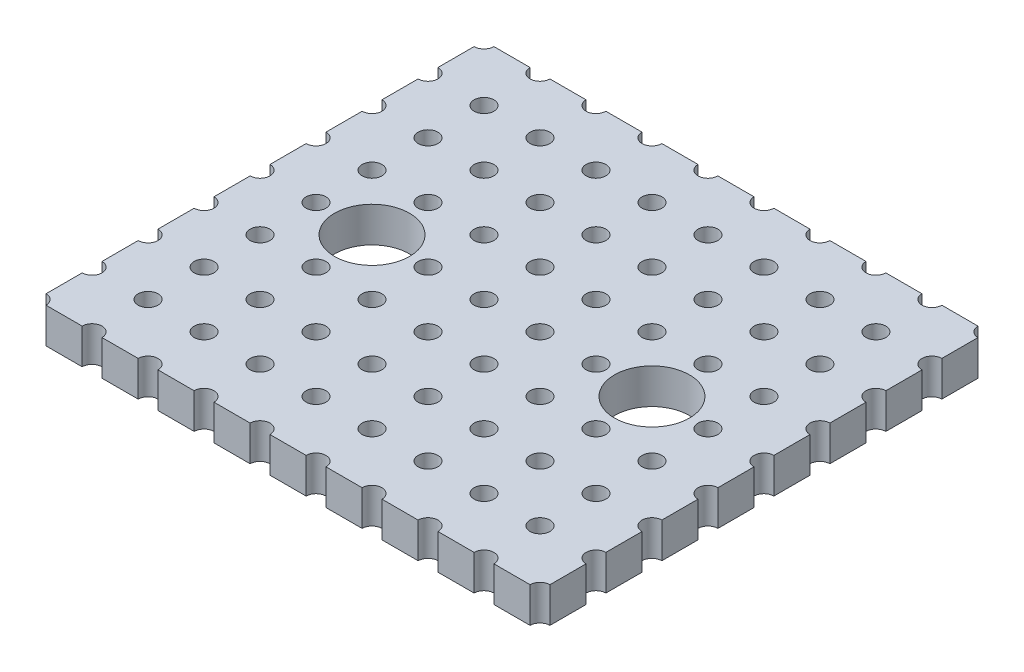
from build123d import *

# Parameters (mm, degrees)
ESQUISSE1_W             = 22.86
ESQUISSE1_H             = 20.32
BOSS_EXTRU_1_DEPTH      = 1.6
ESQUISSE2_R             = 0.45
ENL_V_MAT_EXTRU_1_DEPTH = 26.387611646
D_GAGEMENT_M31_D        = 3.4


with BuildPart() as part:
    # Esquisse1 → Boss.-Extru.1 (new body)
    with BuildSketch(Plane(origin=(0, 0, 0), x_dir=(1, 0, 0), z_dir=(0, 1, 0))):
        with Locations((7.545294118, -6.630147059)):
            Rectangle(ESQUISSE1_W, ESQUISSE1_H)
    extrude(amount=BOSS_EXTRU_1_DEPTH)

    # Esquisse2 → Enlèv. mat.-Extru.1 (cut, through all)
    with BuildSketch(Plane(origin=(0, 1.6, 0), x_dir=(1, 0, 0), z_dir=(0, 1, 0))):
        with Locations((-3.884705882, 3.529852941)):
            Circle(ESQUISSE2_R)
        with Locations((-1.344705882, 3.529852941)):
            Circle(ESQUISSE2_R)
        with Locations((1.195294118, 3.529852941)):
            Circle(ESQUISSE2_R)
        with Locations((3.735294118, 3.529852941)):
            Circle(ESQUISSE2_R)
        with Locations(Location((-1.344705882, 0.989852941, 0), (0, 0, 270))):
            Circle(ESQUISSE2_R)
        with Locations(Location((1.195294118, 0.989852941, 0), (0, 0, 270))):
            Circle(ESQUISSE2_R)
        with Locations(Location((3.735294118, 0.989852941, 0), (0, 0, 270))):
            Circle(ESQUISSE2_R)
        with Locations(Location((-1.344705882, -1.550147059, 0), (0, 0, 270))):
            Circle(ESQUISSE2_R)
        with Locations(Location((1.195294118, -1.550147059, 0), (0, 0, 270))):
            Circle(ESQUISSE2_R)
        with Locations(Location((3.735294118, -1.550147059, 0), (0, 0, 270))):
            Circle(ESQUISSE2_R)
        with Locations(Location((-1.344705882, -4.090147059, 0), (0, 0, 270))):
            Circle(ESQUISSE2_R)
        with Locations(Location((1.195294118, -4.090147059, 0), (0, 0, 270))):
            Circle(ESQUISSE2_R)
        with Locations(Location((3.735294118, -4.090147059, 0), (0, 0, 270))):
            Circle(ESQUISSE2_R)
        with Locations(Location((-1.344705882, -6.630147059, 0), (0, 0, 270))):
            Circle(ESQUISSE2_R)
        with Locations(Location((1.195294118, -6.630147059, 0), (0, 0, 270))):
            Circle(ESQUISSE2_R)
        with Locations(Location((3.735294118, -6.630147059, 0), (0, 0, 270))):
            Circle(ESQUISSE2_R)
        with Locations(Location((-1.344705882, -9.170147059, 0), (0, 0, 270))):
            Circle(ESQUISSE2_R)
        with Locations(Location((1.195294118, -9.170147059, 0), (0, 0, 270))):
            Circle(ESQUISSE2_R)
        with Locations(Location((3.735294118, -9.170147059, 0), (0, 0, 270))):
            Circle(ESQUISSE2_R)
        with Locations(Location((-1.344705882, -11.710147059, 0), (0, 0, 270))):
            Circle(ESQUISSE2_R)
        with Locations(Location((1.195294118, -11.710147059, 0), (0, 0, 270))):
            Circle(ESQUISSE2_R)
        with Locations(Location((3.735294118, -11.710147059, 0), (0, 0, 270))):
            Circle(ESQUISSE2_R)
        with Locations(Location((-1.344705882, -14.250147059, 0), (0, 0, 270))):
            Circle(ESQUISSE2_R)
        with Locations(Location((1.195294118, -14.250147059, 0), (0, 0, 270))):
            Circle(ESQUISSE2_R)
        with Locations(Location((3.735294118, -14.250147059, 0), (0, 0, 270))):
            Circle(ESQUISSE2_R)
        with Locations((-3.884705882, 0.989852941)):
            Circle(ESQUISSE2_R)
        with Locations((-3.884705882, -1.550147059)):
            Circle(ESQUISSE2_R)
        with Locations((-3.884705882, -4.090147059)):
            Circle(ESQUISSE2_R)
        with Locations((-3.884705882, -6.630147059)):
            Circle(ESQUISSE2_R)
        with Locations((-3.884705882, -9.170147059)):
            Circle(ESQUISSE2_R)
        with Locations((-3.884705882, -11.710147059)):
            Circle(ESQUISSE2_R)
        with Locations((-3.884705882, -14.250147059)):
            Circle(ESQUISSE2_R)
        with Locations((6.275294118, 3.529852941)):
            Circle(ESQUISSE2_R)
        with Locations(Location((6.275294118, 0.989852941, 0), (0, 0, 270))):
            Circle(ESQUISSE2_R)
        with Locations(Location((6.275294118, -1.550147059, 0), (0, 0, 270))):
            Circle(ESQUISSE2_R)
        with Locations(Location((6.275294118, -4.090147059, 0), (0, 0, 270))):
            Circle(ESQUISSE2_R)
        with Locations(Location((6.275294118, -6.630147059, 0), (0, 0, 270))):
            Circle(ESQUISSE2_R)
        with Locations(Location((6.275294118, -9.170147059, 0), (0, 0, 270))):
            Circle(ESQUISSE2_R)
        with Locations(Location((6.275294118, -11.710147059, 0), (0, 0, 270))):
            Circle(ESQUISSE2_R)
        with Locations(Location((6.275294118, -14.250147059, 0), (0, 0, 270))):
            Circle(ESQUISSE2_R)
        with Locations((-3.884705882, -16.790147059)):
            Circle(ESQUISSE2_R)
        with Locations((-1.344705882, -16.790147059)):
            Circle(ESQUISSE2_R)
        with Locations((1.195294118, -16.790147059)):
            Circle(ESQUISSE2_R)
        with Locations((3.735294118, -16.790147059)):
            Circle(ESQUISSE2_R)
        with Locations((6.275294118, -16.790147059)):
            Circle(ESQUISSE2_R)
        with Locations((8.815294118, 3.529852941)):
            Circle(ESQUISSE2_R)
        with Locations((11.355294118, 3.529852941)):
            Circle(ESQUISSE2_R)
        with Locations((13.895294118, 3.529852941)):
            Circle(ESQUISSE2_R)
        with Locations((16.435294118, 3.529852941)):
            Circle(ESQUISSE2_R)
        with Locations((18.975294118, 3.529852941)):
            Circle(ESQUISSE2_R)
        with Locations(Location((8.815294118, 0.989852941, 0), (0, 0, 270))):
            Circle(ESQUISSE2_R)
        with Locations(Location((11.355294118, 0.989852941, 0), (0, 0, 270))):
            Circle(ESQUISSE2_R)
        with Locations(Location((13.895294118, 0.989852941, 0), (0, 0, 270))):
            Circle(ESQUISSE2_R)
        with Locations(Location((16.435294118, 0.989852941, 0), (0, 0, 270))):
            Circle(ESQUISSE2_R)
        with Locations((18.975294118, 0.989852941)):
            Circle(ESQUISSE2_R)
        with Locations(Location((8.815294118, -1.550147059, 0), (0, 0, 270))):
            Circle(ESQUISSE2_R)
        with Locations(Location((11.355294118, -1.550147059, 0), (0, 0, 270))):
            Circle(ESQUISSE2_R)
        with Locations(Location((13.895294118, -1.550147059, 0), (0, 0, 270))):
            Circle(ESQUISSE2_R)
        with Locations(Location((16.435294118, -1.550147059, 0), (0, 0, 270))):
            Circle(ESQUISSE2_R)
        with Locations((18.975294118, -1.550147059)):
            Circle(ESQUISSE2_R)
        with Locations(Location((8.815294118, -4.090147059, 0), (0, 0, 270))):
            Circle(ESQUISSE2_R)
        with Locations(Location((11.355294118, -4.090147059, 0), (0, 0, 270))):
            Circle(ESQUISSE2_R)
        with Locations(Location((13.895294118, -4.090147059, 0), (0, 0, 270))):
            Circle(ESQUISSE2_R)
        with Locations(Location((16.435294118, -4.090147059, 0), (0, 0, 270))):
            Circle(ESQUISSE2_R)
        with Locations((18.975294118, -4.090147059)):
            Circle(ESQUISSE2_R)
        with Locations(Location((8.815294118, -6.630147059, 0), (0, 0, 270))):
            Circle(ESQUISSE2_R)
        with Locations(Location((11.355294118, -6.630147059, 0), (0, 0, 270))):
            Circle(ESQUISSE2_R)
        with Locations(Location((13.895294118, -6.630147059, 0), (0, 0, 270))):
            Circle(ESQUISSE2_R)
        with Locations(Location((16.435294118, -6.630147059, 0), (0, 0, 270))):
            Circle(ESQUISSE2_R)
        with Locations((18.975294118, -6.630147059)):
            Circle(ESQUISSE2_R)
        with Locations(Location((8.815294118, -9.170147059, 0), (0, 0, 270))):
            Circle(ESQUISSE2_R)
        with Locations(Location((11.355294118, -9.170147059, 0), (0, 0, 270))):
            Circle(ESQUISSE2_R)
        with Locations(Location((13.895294118, -9.170147059, 0), (0, 0, 270))):
            Circle(ESQUISSE2_R)
        with Locations(Location((16.435294118, -9.170147059, 0), (0, 0, 270))):
            Circle(ESQUISSE2_R)
        with Locations((18.975294118, -9.170147059)):
            Circle(ESQUISSE2_R)
        with Locations(Location((8.815294118, -11.710147059, 0), (0, 0, 270))):
            Circle(ESQUISSE2_R)
        with Locations(Location((11.355294118, -11.710147059, 0), (0, 0, 270))):
            Circle(ESQUISSE2_R)
        with Locations(Location((13.895294118, -11.710147059, 0), (0, 0, 270))):
            Circle(ESQUISSE2_R)
        with Locations(Location((16.435294118, -11.710147059, 0), (0, 0, 270))):
            Circle(ESQUISSE2_R)
        with Locations((18.975294118, -11.710147059)):
            Circle(ESQUISSE2_R)
        with Locations(Location((8.815294118, -14.250147059, 0), (0, 0, 270))):
            Circle(ESQUISSE2_R)
        with Locations(Location((11.355294118, -14.250147059, 0), (0, 0, 270))):
            Circle(ESQUISSE2_R)
        with Locations(Location((13.895294118, -14.250147059, 0), (0, 0, 270))):
            Circle(ESQUISSE2_R)
        with Locations(Location((16.435294118, -14.250147059, 0), (0, 0, 270))):
            Circle(ESQUISSE2_R)
        with Locations((18.975294118, -14.250147059)):
            Circle(ESQUISSE2_R)
        with Locations((8.815294118, -16.790147059)):
            Circle(ESQUISSE2_R)
        with Locations((11.355294118, -16.790147059)):
            Circle(ESQUISSE2_R)
        with Locations((13.895294118, -16.790147059)):
            Circle(ESQUISSE2_R)
        with Locations((16.435294118, -16.790147059)):
            Circle(ESQUISSE2_R)
        with Locations((18.975294118, -16.790147059)):
            Circle(ESQUISSE2_R)
    extrude(amount=-ENL_V_MAT_EXTRU_1_DEPTH, mode=Mode.SUBTRACT)

    # Dégagement M31 (through all)
    with Locations(Plane(origin=(0, 1.6, 0), x_dir=(1, 0, 0), z_dir=(0, 1, 0))):
        with Locations((13.895294118, -6.630147059), (1.195294118, -6.630147059)):
            Hole(D_GAGEMENT_M31_D / 2)


solid = part.part
